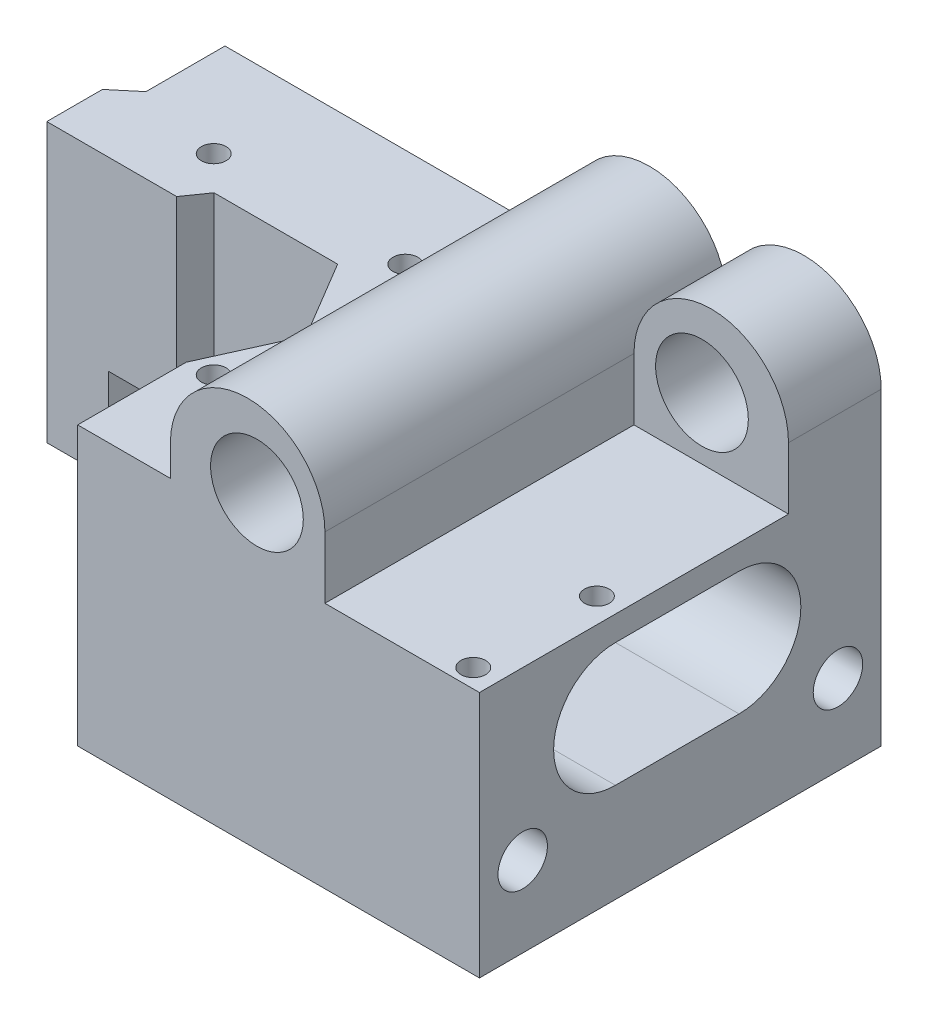
from build123d import *

# Parameters (mm, degrees)
SKETCH1_R               = 7.5
BOSS_EXTRUDE1_DEPTH     = 15
SKETCH2_R               = 7.5
BOSS_EXTRUDE2_DEPTH     = 50
SKETCH3_W               = 50
SKETCH3_H               = 40
BOSS_EXTRUDE3_DEPTH     = 65
CUT_EXTRUDE1_DEPTH      = 105.024035684
CUT_EXTRUDE2_DEPTH      = 96.372952141
BOSS_EXTRUDE7_START     = -15
SKETCH6_R               = 2
BOSS_EXTRUDE7_DEPTH     = 30
SKETCH8_W               = 15
SKETCH8_H               = 10
BOSS_EXTRUDE10_DEPTH    = 15
SKETCH9_R               = 4
CUT_EXTRUDE3_DEPTH      = 109.310895112
CUT_EXTRUDE6_DEPTH      = 20
ESQUISSE1_R             = 2
ENL_V_MAT_EXTRU_1_DEPTH = 10


with BuildPart() as part:
    # Sketch1 → Boss-Extrude1 (new body)
    with BuildSketch(Plane.XY):
        with BuildLine():
            Line((0, 0), (50, 0))
            Line((50, 0), (50, 50))
            ThreePointArc((50, 50), (40.582575695, 63.228756555), (25, 58.660254038))
            ThreePointArc((25, 58.660254038), (9.417424305, 63.228756555), (0, 50))
            Line((0, 50), (0, 0))
        make_face()
        with Locations((36, 50)):
            Circle(SKETCH1_R, mode=Mode.SUBTRACT)
        with Locations((14, 50)):
            Circle(SKETCH1_R, mode=Mode.SUBTRACT)
    extrude(amount=BOSS_EXTRUDE1_DEPTH)

    # Sketch2 → Boss-Extrude2 (add)
    with BuildSketch(Plane.XY.offset(15)):
        with BuildLine():
            Line((0, 50), (0, 0))
            Line((0, 0), (25, 0))
            Line((25, 0), (25, 50))
            ThreePointArc((25, 50), (12.5, 62.5), (0, 50))
        make_face()
        with Locations((14, 50)):
            Circle(SKETCH2_R, mode=Mode.SUBTRACT)
    extrude(amount=BOSS_EXTRUDE2_DEPTH)

    # Sketch3 → Boss-Extrude3 (add)
    with BuildSketch(Plane(origin=(0, 0, 0), x_dir=(-1, 0, 0), z_dir=(0, 0, -1))):
        with Locations((-25, 20)):
            Rectangle(SKETCH3_W, SKETCH3_H)
    extrude(amount=-BOSS_EXTRUDE3_DEPTH)

    # Sketch4 → Cut-Extrude1 (cut, through all)
    with BuildSketch(Plane.ZY):
        with BuildLine():
            Line((23, 36), (43, 36))
            ThreePointArc((43, 36), (53, 26), (43, 16))
            Line((43, 16), (23, 16))
            ThreePointArc((23, 16), (13, 26), (23, 36))
        make_face()
    extrude(amount=-CUT_EXTRUDE1_DEPTH, mode=Mode.SUBTRACT)

    # Sketch2<3> → Cut-Extrude2 (cut, through all)
    with BuildSketch(Plane.XY.offset(15)):
        with BuildLine():
            ThreePointArc((25, 58.660254038), (9.417424305, 63.228756555), (0, 50))
            ThreePointArc((0, 50), (12.5, 62.5), (25, 50))
            ThreePointArc((25, 50), (37.5, 62.5), (50, 50))
            ThreePointArc((50, 50), (40.582575695, 63.228756555), (25, 58.660254038))
        make_face()
    extrude(amount=-CUT_EXTRUDE2_DEPTH, mode=Mode.SUBTRACT)

    # Sketch6 → Boss-Extrude7 (add)
    with BuildSketch(Plane.XZ.offset(BOSS_EXTRUDE7_START)):
        Polygon((0, 65), (-15, 65), (-15, 47.450556951), (-8.979909906, 34.061546791), (-16.494563126, 21.450556951), (-36.494563126, 21.450556951), (-38.979909906, 25), (-60, 25), (-60, 16), (-56.169777784, 12.786061952), (-56.169777784, 0), (0, 0), align=None)
        with Locations((-41.994563126, 16)):
            Circle(SKETCH6_R, mode=Mode.SUBTRACT)
        with Locations((-10.994563126, 16)):
            Circle(SKETCH6_R, mode=Mode.SUBTRACT)
        with Locations((-10.994563126, 47)):
            Circle(SKETCH6_R, mode=Mode.SUBTRACT)
    extrude(amount=-BOSS_EXTRUDE7_DEPTH)

    # Sketch8 → Boss-Extrude10 (add)
    with BuildSketch(Plane(origin=(0, 15, 0), x_dir=(-1, 0, 0), z_dir=(0, -1, 0))):
        Polygon((50, -25), (60, -25), (60, -16), (56.169777784, -12.786061952), (56.169777784, 0), (0, 0), (0, -10), (50, -10), align=None)
        with Locations((7.5, -60)):
            Rectangle(SKETCH8_W, SKETCH8_H)
    extrude(amount=BOSS_EXTRUDE10_DEPTH)

    # Sketch9 → Cut-Extrude3 (cut, through all)
    with BuildSketch(Plane.ZY):
        with Locations((58, 13)):
            Circle(SKETCH9_R)
        with Locations((7, 13)):
            Circle(SKETCH9_R)
    extrude(amount=-CUT_EXTRUDE3_DEPTH, mode=Mode.SUBTRACT)

    # Sketch10 → Cut-Extrude6 (cut)
    with BuildSketch(Plane(origin=(0, 0, 0), x_dir=(0, 0, -1), z_dir=(1, 0, 0))):
        with BuildLine():
            Line((-37, 33), (-27, 33))
            ThreePointArc((-27, 33), (-20, 26), (-27, 19))
            Line((-27, 19), (-37, 19))
            ThreePointArc((-37, 19), (-44, 26), (-37, 33))
        make_face()
    extrude(amount=-CUT_EXTRUDE6_DEPTH, mode=Mode.SUBTRACT)

    # Esquisse1 → Enlèv. mat.-Extru.1 (cut)
    with BuildSketch(Plane(origin=(0, 40, 0), x_dir=(1, 0, 0), z_dir=(0, 1, 0))):
        with Locations((46, -42)):
            Circle(ESQUISSE1_R)
        with Locations((46, -62)):
            Circle(ESQUISSE1_R)
    extrude(amount=-ENL_V_MAT_EXTRU_1_DEPTH, mode=Mode.SUBTRACT)


solid = part.part
